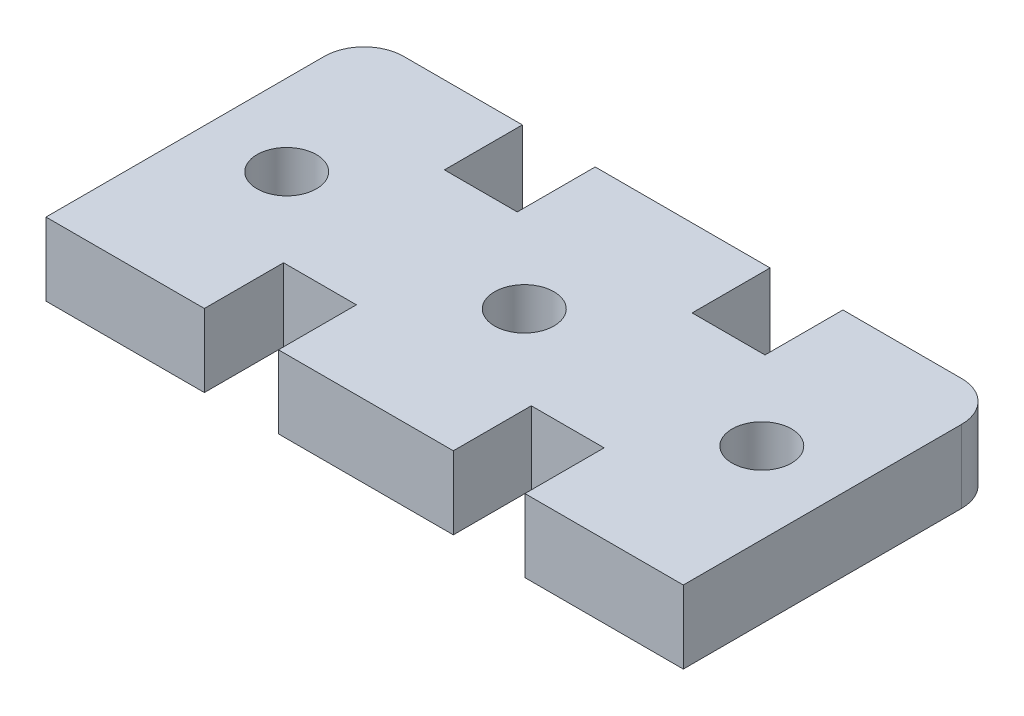
from build123d import *

# Parameters (mm, degrees)
BOSS_EXTRUDE1_DEPTH = 5.842
SKETCH3_R           = 2.38125
CUT_EXTRUDE2_DEPTH  = 30.127751029
FILLET1_R           = 3.175
SKETCH4_W           = 12.7
SKETCH4_H           = 0.1
BOSS_EXTRUDE2_DEPTH = 5.842


with BuildPart() as part:
    # Sketch1 → Boss-Extrude1 (new body)
    with BuildSketch(Plane(origin=(0, 0, 0), x_dir=(1, 0, 0), z_dir=(0, 1, 0))):
        Polygon((7.012, -12.7), (-7.012, -12.7), (-7.012, -6.45), (-12.854, -6.45), (-12.854, -12.7), (-25.554, -12.7), (-25.554, 12.7), (-12.854, 12.7), (-12.854, 6.45), (-7.012, 6.45), (-7.012, 12.7), (7.012, 12.7), (7.012, 6.45), (12.854, 6.45), (12.854, 12.7), (25.554, 12.7), (25.554, -12.7), (12.854, -12.7), (12.854, -6.45), (7.012, -6.45), align=None)
    extrude(amount=BOSS_EXTRUDE1_DEPTH)

    # Sketch3 → Cut-Extrude2 (cut, through all)
    with BuildSketch(Plane(origin=(0, 5.842, 0), x_dir=(1, 0, 0), z_dir=(0, 1, 0))):
        with Locations(Location((0, 0, 0), (0, 0, 270))):
            Circle(SKETCH3_R)
        with Locations(Location((-19.05, 0, 0), (0, 0, 270))):
            Circle(SKETCH3_R)
        with Locations(Location((19.05, 0, 0), (0, 0, 90))):
            Circle(SKETCH3_R)
    extrude(amount=-CUT_EXTRUDE2_DEPTH, mode=Mode.SUBTRACT)

    # Fillet1
    fillet1_edges = [part.edges().sort_by_distance(p)[0] for p in [
        (25.554, 2.921, -12.7),
        (-25.554, 2.921, -12.7),
    ]]
    fillet(fillet1_edges, radius=FILLET1_R)

    # Sketch4 → Boss-Extrude2 (add)
    with BuildSketch(Plane(origin=(0, 5.842, 0), x_dir=(1, 0, 0), z_dir=(0, 1, 0))):
        with Locations((-19.204, -12.75)):
            Rectangle(SKETCH4_W, SKETCH4_H)
        with Locations((19.204, -12.75)):
            Rectangle(SKETCH4_W, SKETCH4_H)
    extrude(amount=-BOSS_EXTRUDE2_DEPTH)


solid = part.part
